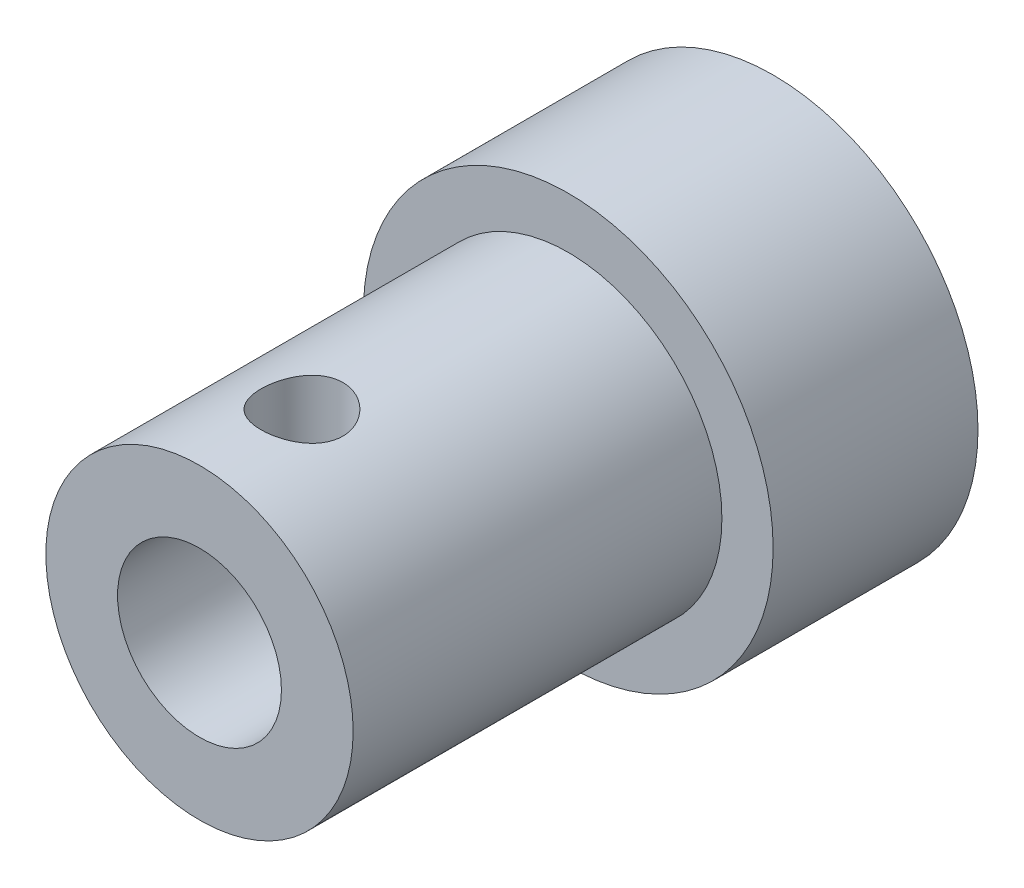
from build123d import *

# Parameters (mm, degrees)
SKETCH1_R           = 7.5
SKETCH1_R_2         = 4
BOSS_EXTRUDE1_DEPTH = 5
SKETCH3_R           = 10
SKETCH3_R_2         = 1.5
BOSS_EXTRUDE3_DEPTH = 8
BOSS_EXTRUDE4_START = 15
SKETCH4_R           = 7.5
SKETCH4_R_2         = 4
BOSS_EXTRUDE4_DEPTH = 15
SKETCH2_R           = 2
CUT_EXTRUDE1_DEPTH  = 7
SKETCH6_R           = 4
CUT_EXTRUDE2_DEPTH  = 32.368774283
BOSS_EXTRUDE5_START = 2
SKETCH7_R           = 10
SKETCH7_R_2         = 4
BOSS_EXTRUDE5_DEPTH = 2


with BuildPart() as part:
    # Sketch1 → Boss-Extrude1 (new body)
    # profile 1 of 2: a face of its own
    with BuildSketch(Plane.XY):
        Circle(SKETCH1_R)
        Circle(SKETCH1_R_2, mode=Mode.SUBTRACT)
    # profile 2 of 2: a face of its own
    with BuildSketch(Plane.XY):
        Circle(SKETCH1_R_2)
    extrude(amount=-BOSS_EXTRUDE1_DEPTH)

    # Sketch3 → Boss-Extrude3 (add)
    with BuildSketch(Plane(origin=(0, 0, -5), x_dir=(-1, 0, 0), z_dir=(0, 0, -1))):
        Circle(SKETCH3_R)
        with Locations(Location((0, 7, 0), (0, 0, 166.225853002))):
            Circle(SKETCH3_R_2, mode=Mode.SUBTRACT)
        with Locations(Location((7, 0, 0), (0, 0, 283.774146998))):
            Circle(SKETCH3_R_2, mode=Mode.SUBTRACT)
        with Locations(Location((0, -7, 0), (0, 0, 193.774146998))):
            Circle(SKETCH3_R_2, mode=Mode.SUBTRACT)
        with Locations(Location((-7, 0, 0), (0, 0, 256.225853002))):
            Circle(SKETCH3_R_2, mode=Mode.SUBTRACT)
    extrude(amount=BOSS_EXTRUDE3_DEPTH)

    # Sketch4 → Boss-Extrude4 (add)
    with BuildSketch(Plane.XY.offset(BOSS_EXTRUDE4_START)):
        Circle(SKETCH4_R)
        Circle(SKETCH4_R_2, mode=Mode.SUBTRACT)
    extrude(amount=-BOSS_EXTRUDE4_DEPTH)

    # Sketch2 → Cut-Extrude1 (cut)
    with BuildSketch(Plane(origin=(0, 7.5, 0), x_dir=(1, 0, 0), z_dir=(0, 1, 0))):
        with Locations(Location((0, -10, 0), (0, 0, 270))):
            Circle(SKETCH2_R)
    extrude(amount=-CUT_EXTRUDE1_DEPTH, mode=Mode.SUBTRACT)

    # Sketch6 → Cut-Extrude2 (cut, through all)
    with BuildSketch(Plane.XY.offset(15)):
        Circle(SKETCH6_R)
    extrude(amount=-CUT_EXTRUDE2_DEPTH, mode=Mode.SUBTRACT)

    # Sketch7 → Boss-Extrude5 (add)
    with BuildSketch(Plane.XY.offset(-5).offset(BOSS_EXTRUDE5_START)):
        Circle(SKETCH7_R)
        Circle(SKETCH7_R_2, mode=Mode.SUBTRACT)
    extrude(amount=-BOSS_EXTRUDE5_DEPTH)


solid = part.part
